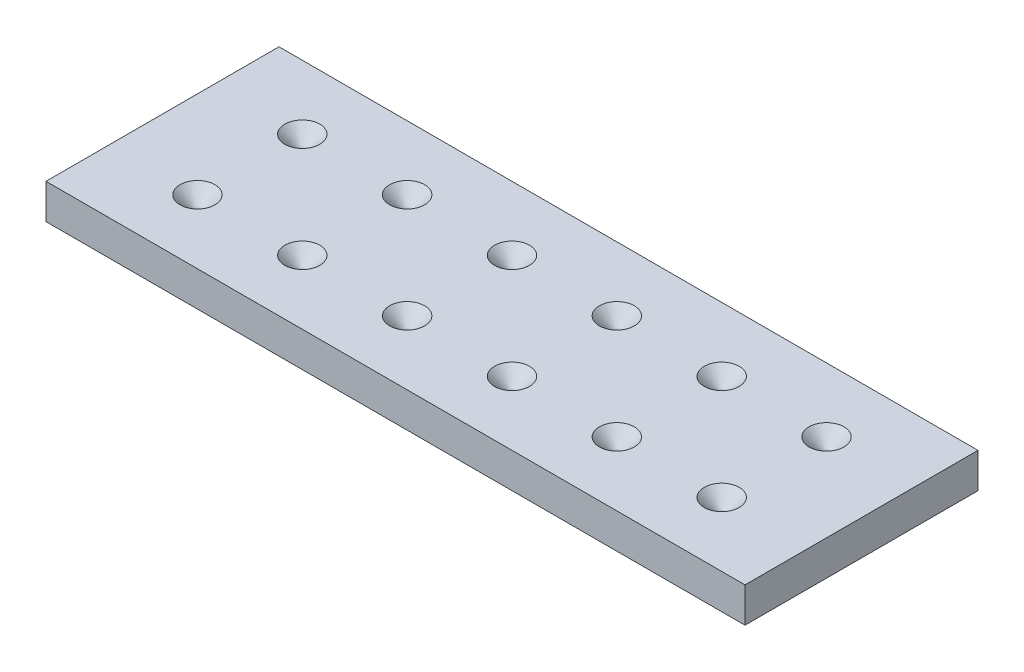
from build123d import *

# Parameters (mm, degrees)
SKETCH1_W            = 60
SKETCH1_H            = 20
BOSS_EXTRUDE1_DEPTH  = 3
LPATTERN1_COUNT      = 6
LPATTERN1_PITCH      = 9
LPATTERN1_COUNT_DIR2 = 2
LPATTERN1_PITCH_DIR2 = 9


with BuildPart() as part:
    # Sketch1 → Boss-Extrude1 (new body)
    with BuildSketch(Plane(origin=(0, 0, 0), x_dir=(1, 0, 0), z_dir=(0, 1, 0))):
        Rectangle(SKETCH1_W, SKETCH1_H)
    extrude(amount=BOSS_EXTRUDE1_DEPTH)

    # Cut-Extrude1 cone 1 section (through the dimple's axis) → Cut-Extrude1 (revolve, cut)
    with BuildSketch(Plane(origin=(-22.5, 3, 4.5), x_dir=(0, 0, 1), z_dir=(1, 0, 0))):
        Polygon((0, 0), (1.5, 0), (0, 1.5), align=None)
    cut_extrude1 = revolve(axis=Axis((-22.5, 3, 4.5), (0, -1, 0)), mode=Mode.SUBTRACT)

    # LPattern1: Cut-Extrude1 6 × 2
    with Locations(*[(i * LPATTERN1_PITCH, 0, -j * LPATTERN1_PITCH_DIR2) for i in range(LPATTERN1_COUNT) for j in range(LPATTERN1_COUNT_DIR2) if (i, j) != (0, 0)]):
        add(cut_extrude1, mode=Mode.SUBTRACT)


solid = part.part
